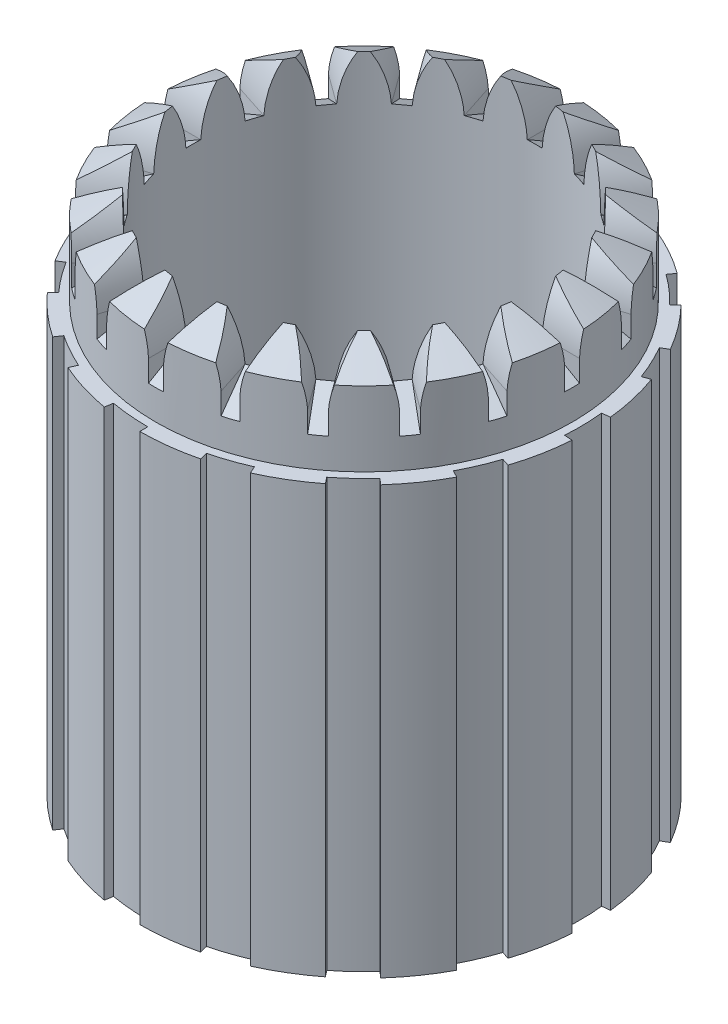
from build123d import *

# Parameters (mm, degrees)
SKETCH1_R           = 21
BOSS_EXTRUDE1_DEPTH = 40
SKETCH3_R           = 19.5
BOSS_EXTRUDE2_DEPTH = 9
SKETCH4_R           = 16
CUT_EXTRUDE1_DEPTH  = 59
CUT_EXTRUDE2_DEPTH  = 50
CUT_EXTRUDE3_DEPTH  = 24
CIRPATTERN2_COUNT   = 20
CUT_EXTRUDE4_DEPTH  = 0.695
CIRPATTERN3_COUNT   = 20


with BuildPart() as part:
    # Sketch1 → Boss-Extrude1 (new body)
    with BuildSketch(Plane(origin=(0, 0, 0), x_dir=(1, 0, 0), z_dir=(0, 1, 0))):
        with Locations(Location((0, 0, 0), (0, 0, 270))):
            Circle(SKETCH1_R)
    extrude(amount=BOSS_EXTRUDE1_DEPTH)

    # Sketch3 → Boss-Extrude2 (add)
    with BuildSketch(Plane(origin=(0, 40, 0), x_dir=(1, 0, 0), z_dir=(0, 1, 0))):
        with Locations(Location((0, 0, 0), (0, 0, 270))):
            Circle(SKETCH3_R)
    extrude(amount=BOSS_EXTRUDE2_DEPTH)

    # Sketch4 → Cut-Extrude1 (cut)
    with BuildSketch(Plane(origin=(0, 49, 0), x_dir=(1, 0, 0), z_dir=(0, 1, 0))):
        with Locations(Location((0, 0, 0), (0, 0, 270))):
            Circle(SKETCH4_R)
    extrude(amount=-CUT_EXTRUDE1_DEPTH, mode=Mode.SUBTRACT)

    # Sketch5 → Cut-Extrude2 (cut)
    with BuildSketch(Plane.XZ):
        with BuildLine():
            ThreePointArc((8.541469505, 19.18445461), (6.836931244, 19.855890088), (5.080359808, 20.376210252))
            Line((5.080359808, 20.376210252), (4.898918386, 19.648488457))
            ThreePointArc((4.898918386, 19.648488457), (6.592755128, 19.146751156), (8.236417022, 18.499295517))
            Line((8.236417022, 18.499295517), (8.541469505, 19.18445461))
        make_face()
        with BuildLine():
            Line((0, 20.25), (0, 21))
            ThreePointArc((0, 21), (-1.830270598, 20.92008866), (-3.646611731, 20.680962813))
            Line((-3.646611731, 20.680962813), (-3.516375598, 19.942356998))
            ThreePointArc((-3.516375598, 19.942356998), (-1.764903791, 20.172942636), (0, 20.25))
        make_face()
        with BuildLine():
            Line((-17.537014427, -10.125), (-18.186533479, -10.5))
            ThreePointArc((-18.186533479, -10.5), (-17.20219293, -12.045105163), (-16.086933305, -13.498539803))
            Line((-16.086933305, -13.498539803), (-15.512399973, -13.016449096))
            ThreePointArc((-15.512399973, -13.016449096), (-16.587828897, -11.614922836), (-17.537014427, -10.125))
        make_face()
        with BuildLine():
            Line((-11.902651359, -16.382594136), (-12.343490298, -16.989356882))
            ThreePointArc((-12.343490298, -16.989356882), (-10.815799573, -18.000513315), (-9.205794083, -18.874674972))
            Line((-9.205794083, -18.874674972), (-8.877015722, -18.200579438))
            ThreePointArc((-8.877015722, -18.200579438), (-10.429521017, -17.357637839), (-11.902651359, -16.382594136))
        make_face()
        with BuildLine():
            Line((-4.210211739, -19.807488915), (-4.366145507, -20.541099615))
            ThreePointArc((-4.366145507, -20.541099615), (-2.559256212, -20.843469184), (-0.732889431, -20.987207367))
            Line((-0.732889431, -20.987207367), (-0.706714808, -20.237664247))
            ThreePointArc((-0.706714808, -20.237664247), (-2.467854204, -20.099059571), (-4.210211739, -19.807488915))
        make_face()
        with BuildLine():
            ThreePointArc((4.366145507, -20.541099615), (6.139805799, -20.082399875), (7.866738462, -19.470860946))
            Line((7.866738462, -19.470860946), (7.585783517, -18.775473055))
            ThreePointArc((7.585783517, -18.775473055), (5.920527021, -19.365171308), (4.210211739, -19.807488915))
            Line((4.210211739, -19.807488915), (4.366145507, -20.541099615))
        make_face()
        with BuildLine():
            ThreePointArc((18.186533479, -10.5), (19.032463528, -8.874983497), (19.733545037, -7.18242301))
            Line((19.733545037, -7.18242301), (19.028775571, -6.925907902))
            ThreePointArc((19.028775571, -6.925907902), (18.352732687, -8.5580198), (17.537014427, -10.125))
            Line((17.537014427, -10.125), (18.186533479, -10.5))
        make_face()
        with BuildLine():
            ThreePointArc((12.343490298, -16.989356882), (13.777239609, -15.848901185), (15.106135807, -14.58782578))
            Line((15.106135807, -14.58782578), (14.566630957, -14.066832002))
            ThreePointArc((14.566630957, -14.066832002), (13.285195337, -15.282869), (11.902651359, -16.382594136))
            Line((11.902651359, -16.382594136), (12.343490298, -16.989356882))
        make_face()
        with BuildLine():
            ThreePointArc((21, 0), (20.987207367, 0.732889431), (20.948845055, 1.464885949))
            Line((20.948845055, 1.464885949), (20.200672018, 1.412568593))
            ThreePointArc((20.200672018, 1.412568593), (20.246915827, -0.35341123), (20.139068381, -2.116701381))
            Line((20.139068381, -2.116701381), (20.884959803, -2.195097729))
            ThreePointArc((20.884959803, -2.195097729), (20.97122023, -1.099055081), (21, 0))
        make_face()
        with BuildLine():
            ThreePointArc((19.972186842, 6.489356882), (19.330601923, 8.205353698), (18.54189945, 9.858902819))
            Line((18.54189945, 9.858902819), (17.879688755, 9.506799146))
            ThreePointArc((17.879688755, 9.506799146), (18.640223282, 7.912305352), (19.258894455, 6.257594136))
            Line((19.258894455, 6.257594136), (19.972186842, 6.489356882))
        make_face()
        with BuildLine():
            ThreePointArc((15.606041335, 14.051742734), (14.321965561, 15.358427734), (12.928890982, 16.548225826))
            Line((12.928890982, 16.548225826), (12.467144875, 15.957217761))
            ThreePointArc((12.467144875, 15.957217761), (13.810466791, 14.809912458), (15.048682716, 13.549894779))
            Line((15.048682716, 13.549894779), (15.606041335, 14.051742734))
        make_face()
        with BuildLine():
            ThreePointArc((-8.541469505, 19.18445461), (-10.181002025, 18.36701385), (-11.743050973, 17.409789024))
            Line((-11.743050973, 17.409789024), (-11.323656295, 16.788010844))
            ThreePointArc((-11.323656295, 16.788010844), (-9.81739481, 17.71104907), (-8.236417022, 18.499295517))
            Line((-8.236417022, 18.499295517), (-8.541469505, 19.18445461))
        make_face()
        with BuildLine():
            ThreePointArc((-15.606041335, 14.051742734), (-16.771345711, 12.638115486), (-17.809010019, 11.128304549))
            Line((-17.809010019, 11.128304549), (-17.172973947, 10.730865101))
            ThreePointArc((-17.172973947, 10.730865101), (-16.172369078, 12.186754219), (-15.048682716, 13.549894779))
            Line((-15.048682716, 13.549894779), (-15.606041335, 14.051742734))
        make_face()
        with BuildLine():
            ThreePointArc((-19.972186842, 6.489356882), (-20.46177136, 4.723972141), (-20.795629444, 2.92263512))
            Line((-20.795629444, 2.92263512), (-20.052928392, 2.818255294))
            ThreePointArc((-20.052928392, 2.818255294), (-19.730993812, 4.55525885), (-19.258894455, 6.257594136))
            Line((-19.258894455, 6.257594136), (-19.972186842, 6.489356882))
        make_face()
        with BuildLine():
            ThreePointArc((-20.884959803, -2.195097729), (-20.614170852, -4.006988903), (-20.186495615, -5.788384472))
            Line((-20.186495615, -5.788384472), (-19.465549343, -5.581656455))
            ThreePointArc((-19.465549343, -5.581656455), (-19.877950465, -3.863882156), (-20.139068381, -2.116701381))
            Line((-20.139068381, -2.116701381), (-20.884959803, -2.195097729))
        make_face()
    extrude(amount=-CUT_EXTRUDE2_DEPTH, mode=Mode.SUBTRACT)

    # Sketch8 → Cut-Revolve4 (revolve, cut)
    with BuildSketch(Plane.XY, mode=Mode.PRIVATE) as cut_revolve4_sk:
        Polygon((16, 49), (19.5, 49), (19.5, 46.979274058), align=None)
    revolve(cut_revolve4_sk.sketch.rotate(Axis((0, 49, 0), (0, -1, 0)), 90), axis=Axis((0, 49, 0), (0, -1, 0)), mode=Mode.SUBTRACT)

    # Sketch9 → Cut-Extrude3 (cut)
    with BuildSketch(Plane(origin=(0, 0, 0), x_dir=(0, 0, -1), z_dir=(1, 0, 0))):
        with BuildLine():
            Line((-0.695, 44.82), (0.695, 44.82))
            ThreePointArc((0.695, 44.82), (1.107632185, 47.003897431), (2.085, 49))
            Line((2.085, 49), (-2.085, 49))
            ThreePointArc((-2.085, 49), (-1.107632185, 47.003897431), (-0.695, 44.82))
        make_face()
    cut_extrude3 = extrude(amount=CUT_EXTRUDE3_DEPTH, mode=Mode.SUBTRACT)

    # CirPattern2: Cut-Extrude3 ×20 about axis
    cirpattern2_axis = Axis((0, -10, 0), (0, 1, 0))
    for i in range(1, CIRPATTERN2_COUNT):
        add(cut_extrude3.rotate(cirpattern2_axis, i * 360 / CIRPATTERN2_COUNT), mode=Mode.SUBTRACT)

    # Sketch10 → Cut-Extrude4 (cut, symmetric)
    with BuildSketch(Plane(origin=(0, 0, 0), x_dir=(0, 0, -1), z_dir=(1, 0, 0))):
        Polygon((-16, 44.82), (-19.5, 44.82), (-19.5, 42.799274058), align=None)
    cut_extrude4 = extrude(amount=CUT_EXTRUDE4_DEPTH, both=True, mode=Mode.SUBTRACT)

    # CirPattern3: Cut-Extrude4 ×20 about axis
    cirpattern3_axis = Axis((0, 0, 0), (0, 1, 0))
    for i in range(1, CIRPATTERN3_COUNT):
        add(cut_extrude4.rotate(cirpattern3_axis, i * 360 / CIRPATTERN3_COUNT), mode=Mode.SUBTRACT)


solid = part.part
